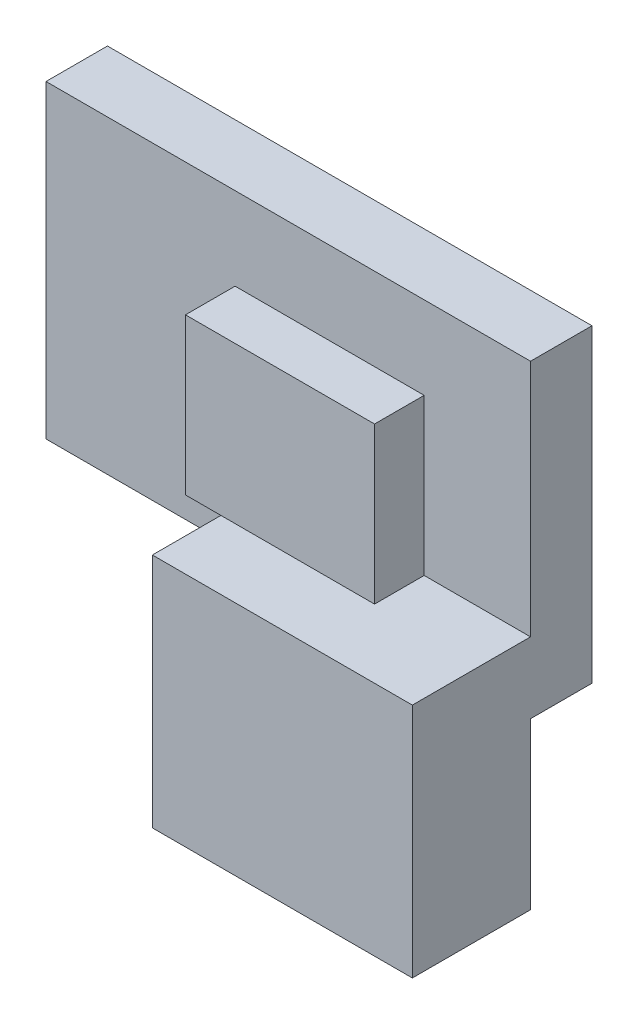
from build123d import *

# Parameters (mm, degrees)
PLACAESBOCO_W      = 20.5
PLACAESBOCO_H      = 13.1
PLACA_DEPTH        = 1.3
CONECTORESBOCO_W   = 11
CONECTORESBOCO_H   = 10
CONECTOR_DEPTH     = 5
RESISTORESESBOCO_W = 8
RESISTORESESBOCO_H = 6.6
RESISTORES_DEPTH   = 2.1


with BuildPart() as part:
    # PlacaEsboco → Placa (new, symmetric)
    with BuildSketch(Plane.XY):
        Rectangle(PLACAESBOCO_W, PLACAESBOCO_H)
    extrude(amount=PLACA_DEPTH, both=True)

    # ConectorEsboco → Conector (add)
    with BuildSketch(Plane.XY.offset(1.3)):
        with Locations((4.75, -8.55)):
            Rectangle(CONECTORESBOCO_W, CONECTORESBOCO_H)
    extrude(amount=CONECTOR_DEPTH)

    # ResistoresEsboco → Resistores (add)
    with BuildSketch(Plane.XY.offset(1.3)):
        with Locations((1.75, -0.25)):
            Rectangle(RESISTORESESBOCO_W, RESISTORESESBOCO_H)
    extrude(amount=RESISTORES_DEPTH)


solid = part.part
